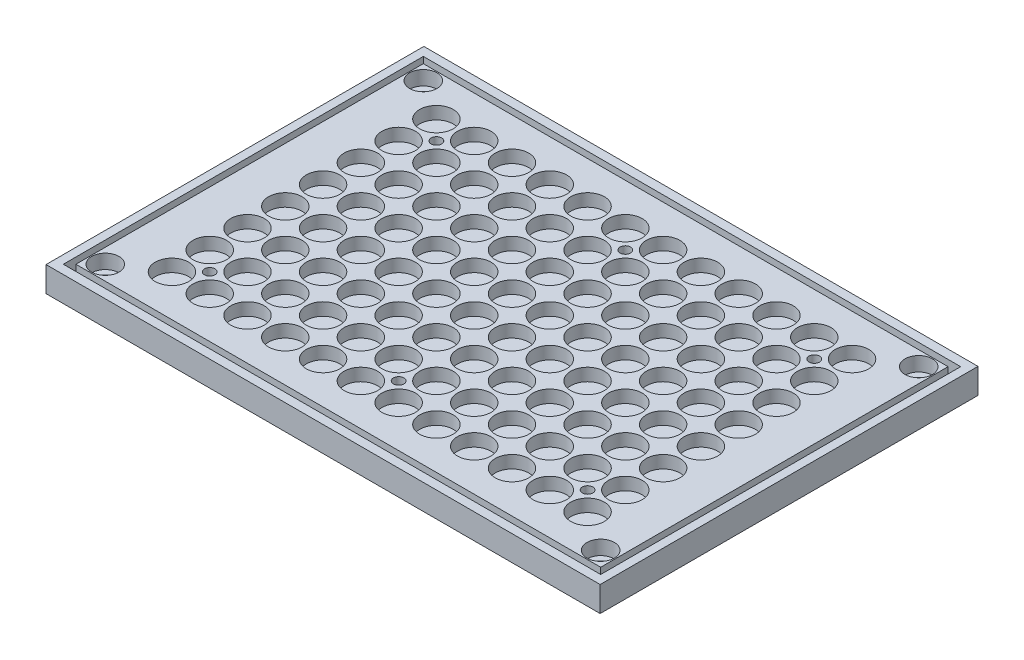
from build123d import *

# Parameters (mm, degrees)
SKETCH1_W                                           = 132
SKETCH1_H                                           = 90
BOSS_EXTRUDE1_DEPTH                                 = 6
SKETCH2_W                                           = 128
SKETCH2_H                                           = 85.75
SKETCH2_W_2                                         = 125
SKETCH2_H_2                                         = 82.75
CUT_EXTRUDE1_DEPTH                                  = 3
SKETCH3_R                                           = 4
CUT_EXTRUDE2_DEPTH                                  = 3
TAP_DRILL_FOR_M3_TAP1_D                             = 2.5
CBORE_FOR_M3_HEX_SOCKET_HEAD_CAP_SCREW2_D           = 3.4
CBORE_FOR_M3_HEX_SOCKET_HEAD_CAP_SCREW2_CBORE_D     = 6.5
CBORE_FOR_M3_HEX_SOCKET_HEAD_CAP_SCREW2_CBORE_DEPTH = 3.4


with BuildPart() as part:
    # Sketch1 → Boss-Extrude1 (new body)
    with BuildSketch(Plane(origin=(0, 0, 0), x_dir=(1, 0, 0), z_dir=(0, 1, 0))):
        Rectangle(SKETCH1_W, SKETCH1_H)
    extrude(amount=BOSS_EXTRUDE1_DEPTH)

    # Sketch2 → Cut-Extrude1 (cut)
    with BuildSketch(Plane(origin=(0, 6, 0), x_dir=(1, 0, 0), z_dir=(0, 1, 0))):
        Rectangle(SKETCH2_W, SKETCH2_H)
        Rectangle(SKETCH2_W_2, SKETCH2_H_2, mode=Mode.SUBTRACT)
    extrude(amount=-CUT_EXTRUDE1_DEPTH, mode=Mode.SUBTRACT)

    # Sketch3 → Cut-Extrude2 (cut)
    with BuildSketch(Plane(origin=(0, 6, 0), x_dir=(1, 0, 0), z_dir=(0, 1, 0))):
        with Locations(Location((-49.5, 31.5, 0), (0, 0, 270))):
            Circle(SKETCH3_R)
        with Locations(Location((-40.5, 31.5, 0), (0, 0, 270))):
            Circle(SKETCH3_R)
        with Locations(Location((-31.5, 31.5, 0), (0, 0, 270))):
            Circle(SKETCH3_R)
        with Locations(Location((-22.5, 31.5, 0), (0, 0, 270))):
            Circle(SKETCH3_R)
        with Locations(Location((-13.5, 31.5, 0), (0, 0, 270))):
            Circle(SKETCH3_R)
        with Locations(Location((-4.5, 31.5, 0), (0, 0, 270))):
            Circle(SKETCH3_R)
        with Locations(Location((4.5, 31.5, 0), (0, 0, 270))):
            Circle(SKETCH3_R)
        with Locations(Location((13.5, 31.5, 0), (0, 0, 270))):
            Circle(SKETCH3_R)
        with Locations(Location((22.5, 31.5, 0), (0, 0, 270))):
            Circle(SKETCH3_R)
        with Locations(Location((31.5, 31.5, 0), (0, 0, 270))):
            Circle(SKETCH3_R)
        with Locations(Location((40.5, 31.5, 0), (0, 0, 270))):
            Circle(SKETCH3_R)
        with Locations(Location((49.5, 31.5, 0), (0, 0, 270))):
            Circle(SKETCH3_R)
        with Locations(Location((-40.5, 22.5, 0), (0, 0, 270))):
            Circle(SKETCH3_R)
        with Locations(Location((-31.5, 22.5, 0), (0, 0, 270))):
            Circle(SKETCH3_R)
        with Locations(Location((-22.5, 22.5, 0), (0, 0, 270))):
            Circle(SKETCH3_R)
        with Locations(Location((-13.5, 22.5, 0), (0, 0, 270))):
            Circle(SKETCH3_R)
        with Locations(Location((-4.5, 22.5, 0), (0, 0, 270))):
            Circle(SKETCH3_R)
        with Locations(Location((4.5, 22.5, 0), (0, 0, 270))):
            Circle(SKETCH3_R)
        with Locations(Location((13.5, 22.5, 0), (0, 0, 270))):
            Circle(SKETCH3_R)
        with Locations(Location((22.5, 22.5, 0), (0, 0, 270))):
            Circle(SKETCH3_R)
        with Locations(Location((31.5, 22.5, 0), (0, 0, 270))):
            Circle(SKETCH3_R)
        with Locations(Location((40.5, 22.5, 0), (0, 0, 270))):
            Circle(SKETCH3_R)
        with Locations(Location((49.5, 22.5, 0), (0, 0, 270))):
            Circle(SKETCH3_R)
        with Locations(Location((-40.5, 13.5, 0), (0, 0, 270))):
            Circle(SKETCH3_R)
        with Locations(Location((-31.5, 13.5, 0), (0, 0, 270))):
            Circle(SKETCH3_R)
        with Locations(Location((-22.5, 13.5, 0), (0, 0, 270))):
            Circle(SKETCH3_R)
        with Locations(Location((-13.5, 13.5, 0), (0, 0, 270))):
            Circle(SKETCH3_R)
        with Locations(Location((-4.5, 13.5, 0), (0, 0, 270))):
            Circle(SKETCH3_R)
        with Locations(Location((4.5, 13.5, 0), (0, 0, 270))):
            Circle(SKETCH3_R)
        with Locations(Location((13.5, 13.5, 0), (0, 0, 270))):
            Circle(SKETCH3_R)
        with Locations(Location((22.5, 13.5, 0), (0, 0, 270))):
            Circle(SKETCH3_R)
        with Locations(Location((31.5, 13.5, 0), (0, 0, 270))):
            Circle(SKETCH3_R)
        with Locations(Location((40.5, 13.5, 0), (0, 0, 270))):
            Circle(SKETCH3_R)
        with Locations(Location((49.5, 13.5, 0), (0, 0, 270))):
            Circle(SKETCH3_R)
        with Locations(Location((-40.5, 4.5, 0), (0, 0, 270))):
            Circle(SKETCH3_R)
        with Locations(Location((-31.5, 4.5, 0), (0, 0, 270))):
            Circle(SKETCH3_R)
        with Locations(Location((-22.5, 4.5, 0), (0, 0, 270))):
            Circle(SKETCH3_R)
        with Locations(Location((-13.5, 4.5, 0), (0, 0, 270))):
            Circle(SKETCH3_R)
        with Locations(Location((-4.5, 4.5, 0), (0, 0, 270))):
            Circle(SKETCH3_R)
        with Locations(Location((4.5, 4.5, 0), (0, 0, 270))):
            Circle(SKETCH3_R)
        with Locations(Location((13.5, 4.5, 0), (0, 0, 270))):
            Circle(SKETCH3_R)
        with Locations(Location((22.5, 4.5, 0), (0, 0, 270))):
            Circle(SKETCH3_R)
        with Locations(Location((31.5, 4.5, 0), (0, 0, 270))):
            Circle(SKETCH3_R)
        with Locations(Location((40.5, 4.5, 0), (0, 0, 270))):
            Circle(SKETCH3_R)
        with Locations(Location((49.5, 4.5, 0), (0, 0, 270))):
            Circle(SKETCH3_R)
        with Locations(Location((-40.5, -4.5, 0), (0, 0, 270))):
            Circle(SKETCH3_R)
        with Locations(Location((-31.5, -4.5, 0), (0, 0, 270))):
            Circle(SKETCH3_R)
        with Locations(Location((-22.5, -4.5, 0), (0, 0, 270))):
            Circle(SKETCH3_R)
        with Locations(Location((-13.5, -4.5, 0), (0, 0, 270))):
            Circle(SKETCH3_R)
        with Locations(Location((-4.5, -4.5, 0), (0, 0, 270))):
            Circle(SKETCH3_R)
        with Locations(Location((4.5, -4.5, 0), (0, 0, 270))):
            Circle(SKETCH3_R)
        with Locations(Location((13.5, -4.5, 0), (0, 0, 270))):
            Circle(SKETCH3_R)
        with Locations(Location((22.5, -4.5, 0), (0, 0, 270))):
            Circle(SKETCH3_R)
        with Locations(Location((31.5, -4.5, 0), (0, 0, 270))):
            Circle(SKETCH3_R)
        with Locations(Location((40.5, -4.5, 0), (0, 0, 270))):
            Circle(SKETCH3_R)
        with Locations(Location((49.5, -4.5, 0), (0, 0, 270))):
            Circle(SKETCH3_R)
        with Locations(Location((-40.5, -13.5, 0), (0, 0, 270))):
            Circle(SKETCH3_R)
        with Locations(Location((-31.5, -13.5, 0), (0, 0, 270))):
            Circle(SKETCH3_R)
        with Locations(Location((-22.5, -13.5, 0), (0, 0, 270))):
            Circle(SKETCH3_R)
        with Locations(Location((-13.5, -13.5, 0), (0, 0, 270))):
            Circle(SKETCH3_R)
        with Locations(Location((-4.5, -13.5, 0), (0, 0, 270))):
            Circle(SKETCH3_R)
        with Locations(Location((4.5, -13.5, 0), (0, 0, 270))):
            Circle(SKETCH3_R)
        with Locations(Location((13.5, -13.5, 0), (0, 0, 270))):
            Circle(SKETCH3_R)
        with Locations(Location((22.5, -13.5, 0), (0, 0, 270))):
            Circle(SKETCH3_R)
        with Locations(Location((31.5, -13.5, 0), (0, 0, 270))):
            Circle(SKETCH3_R)
        with Locations(Location((40.5, -13.5, 0), (0, 0, 270))):
            Circle(SKETCH3_R)
        with Locations(Location((49.5, -13.5, 0), (0, 0, 270))):
            Circle(SKETCH3_R)
        with Locations(Location((-40.5, -22.5, 0), (0, 0, 270))):
            Circle(SKETCH3_R)
        with Locations(Location((-31.5, -22.5, 0), (0, 0, 270))):
            Circle(SKETCH3_R)
        with Locations(Location((-22.5, -22.5, 0), (0, 0, 270))):
            Circle(SKETCH3_R)
        with Locations(Location((-13.5, -22.5, 0), (0, 0, 270))):
            Circle(SKETCH3_R)
        with Locations(Location((-4.5, -22.5, 0), (0, 0, 270))):
            Circle(SKETCH3_R)
        with Locations(Location((4.5, -22.5, 0), (0, 0, 270))):
            Circle(SKETCH3_R)
        with Locations(Location((13.5, -22.5, 0), (0, 0, 270))):
            Circle(SKETCH3_R)
        with Locations(Location((22.5, -22.5, 0), (0, 0, 270))):
            Circle(SKETCH3_R)
        with Locations(Location((31.5, -22.5, 0), (0, 0, 270))):
            Circle(SKETCH3_R)
        with Locations(Location((40.5, -22.5, 0), (0, 0, 270))):
            Circle(SKETCH3_R)
        with Locations(Location((49.5, -22.5, 0), (0, 0, 270))):
            Circle(SKETCH3_R)
        with Locations(Location((-40.5, -31.5, 0), (0, 0, 270))):
            Circle(SKETCH3_R)
        with Locations(Location((-31.5, -31.5, 0), (0, 0, 270))):
            Circle(SKETCH3_R)
        with Locations(Location((-22.5, -31.5, 0), (0, 0, 270))):
            Circle(SKETCH3_R)
        with Locations(Location((-13.5, -31.5, 0), (0, 0, 270))):
            Circle(SKETCH3_R)
        with Locations(Location((-4.5, -31.5, 0), (0, 0, 270))):
            Circle(SKETCH3_R)
        with Locations(Location((4.5, -31.5, 0), (0, 0, 270))):
            Circle(SKETCH3_R)
        with Locations(Location((13.5, -31.5, 0), (0, 0, 270))):
            Circle(SKETCH3_R)
        with Locations(Location((22.5, -31.5, 0), (0, 0, 270))):
            Circle(SKETCH3_R)
        with Locations(Location((31.5, -31.5, 0), (0, 0, 270))):
            Circle(SKETCH3_R)
        with Locations(Location((40.5, -31.5, 0), (0, 0, 270))):
            Circle(SKETCH3_R)
        with Locations(Location((49.5, -31.5, 0), (0, 0, 270))):
            Circle(SKETCH3_R)
        with Locations(Location((-49.5, 22.5, 0), (0, 0, 270))):
            Circle(SKETCH3_R)
        with Locations(Location((-49.5, 13.5, 0), (0, 0, 270))):
            Circle(SKETCH3_R)
        with Locations(Location((-49.5, 4.5, 0), (0, 0, 270))):
            Circle(SKETCH3_R)
        with Locations(Location((-49.5, -4.5, 0), (0, 0, 270))):
            Circle(SKETCH3_R)
        with Locations(Location((-49.5, -13.5, 0), (0, 0, 270))):
            Circle(SKETCH3_R)
        with Locations(Location((-49.5, -22.5, 0), (0, 0, 270))):
            Circle(SKETCH3_R)
        with Locations(Location((-49.5, -31.5, 0), (0, 0, 270))):
            Circle(SKETCH3_R)
    extrude(amount=-CUT_EXTRUDE2_DEPTH, mode=Mode.SUBTRACT)

    # Tap Drill for M3 Tap1 (through all)
    with Locations(Plane(origin=(-45, 6, -27), x_dir=(0, 0, 1), z_dir=(0, 1, 0))):
        with Locations((0, 0), (0, 45), (0, 90), (54, 90), (54, 45), (54, 0)):
            Hole(TAP_DRILL_FOR_M3_TAP1_D / 2)

    # CBORE for M3 Hex Socket Head Cap Screw2 (through all)
    with Locations(Plane(origin=(-59, 6, -37.875), x_dir=(0, 0, 1), z_dir=(0, 1, 0))):
        with Locations((0, 0), (0, 118), (75.75, 0), (75.75, 118)):
            CounterBoreHole(CBORE_FOR_M3_HEX_SOCKET_HEAD_CAP_SCREW2_D / 2, CBORE_FOR_M3_HEX_SOCKET_HEAD_CAP_SCREW2_CBORE_D / 2, CBORE_FOR_M3_HEX_SOCKET_HEAD_CAP_SCREW2_CBORE_DEPTH)


solid = part.part
